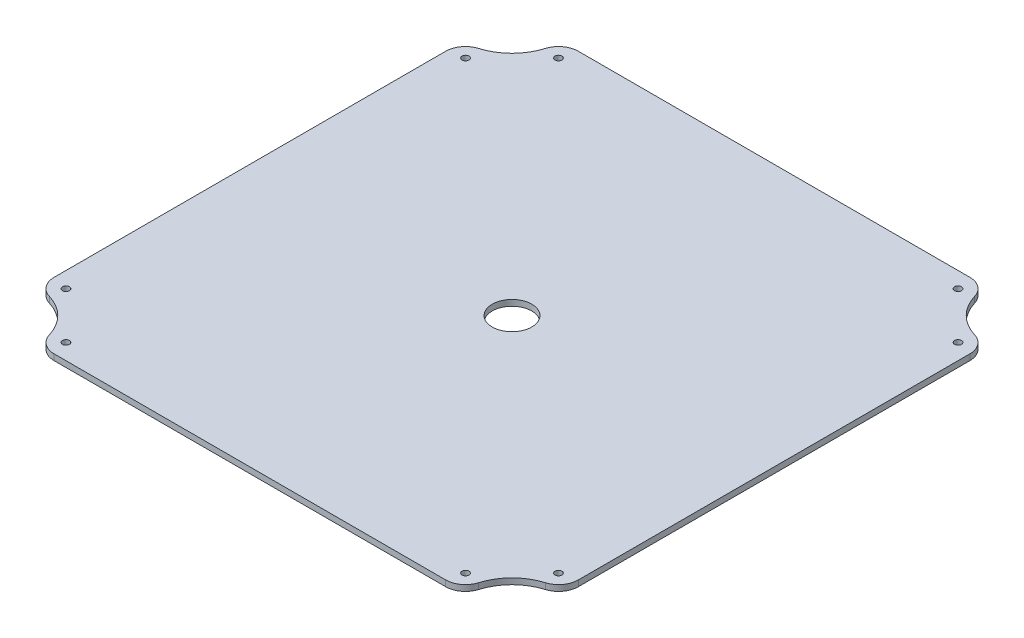
from build123d import *

# Parameters (mm, degrees)
SKETCH_2_W               = 265
SKETCH_2_H               = 265
SKETCH_2_R               = 10
EXTRUDE_585_DEPTH        = 3
CUT_EXTRUDE_2_DEPTH      = 188.407310423
CUT_EXTRUDE_2_DEPTH_BACK = 188.407310423
SKETCH_3_R               = 25
SKETCH_3_R_2             = 1.75
FILLET_2_R               = 10


with BuildPart() as part:
    # 草图2 → Extrude 585 (new body)
    with BuildSketch(Plane(origin=(0, 0, 0), x_dir=(1, 0, 0), z_dir=(0, 1, 0))):
        Rectangle(SKETCH_2_W, SKETCH_2_H)
        with Locations(Location((0, 0, 0), (0, 0, 270))):
            Circle(SKETCH_2_R, mode=Mode.SUBTRACT)
    extrude(amount=EXTRUDE_585_DEPTH)

    # 草图3 → 切除-拉伸2 (cut, two sides: drawn at the far end of the back side and taken through both)
    with BuildSketch(Plane(origin=(0, 3, 0), x_dir=(1, 0, 0), z_dir=(0, 1, 0)).offset(-CUT_EXTRUDE_2_DEPTH_BACK)):
        with Locations((-132.5, -132.5)):
            Circle(SKETCH_3_R)
        with Locations((-132.5, 132.5)):
            Circle(SKETCH_3_R)
        with Locations(Location((-124.5, 101, 0), (0, 0, 270))):
            Circle(SKETCH_3_R_2)
        with Locations(Location((-101, 124.5, 0), (0, 0, 270))):
            Circle(SKETCH_3_R_2)
        with Locations(Location((-124.5, -101, 0), (0, 0, 270))):
            Circle(SKETCH_3_R_2)
        with Locations(Location((-101, -124.5, 0), (0, 0, 270))):
            Circle(SKETCH_3_R_2)
        with Locations((132.5, 132.5)):
            Circle(SKETCH_3_R)
        with Locations(Location((101, 124.5, 0), (0, 0, 270))):
            Circle(SKETCH_3_R_2)
        with Locations(Location((124.5, 101, 0), (0, 0, 270))):
            Circle(SKETCH_3_R_2)
        with Locations((132.5, -132.5)):
            Circle(SKETCH_3_R)
        with Locations(Location((124.5, -101, 0), (0, 0, 270))):
            Circle(SKETCH_3_R_2)
        with Locations(Location((101, -124.5, 0), (0, 0, 270))):
            Circle(SKETCH_3_R_2)
    extrude(amount=CUT_EXTRUDE_2_DEPTH + CUT_EXTRUDE_2_DEPTH_BACK, mode=Mode.SUBTRACT)

    # 圆角2
    fillet_2_edges = [part.edges().sort_by_distance(p)[0] for p in [
        (132.5, 1.5, -107.5),
        (107.5, 1.5, -132.5),
        (-107.5, 1.5, -132.5),
        (-132.5, 1.5, -107.5),
        (107.5, 1.5, 132.5),
        (132.5, 1.5, 107.5),
        (-107.5, 1.5, 132.5),
        (-132.5, 1.5, 107.5),
    ]]
    fillet(fillet_2_edges, radius=FILLET_2_R)


solid = part.part
